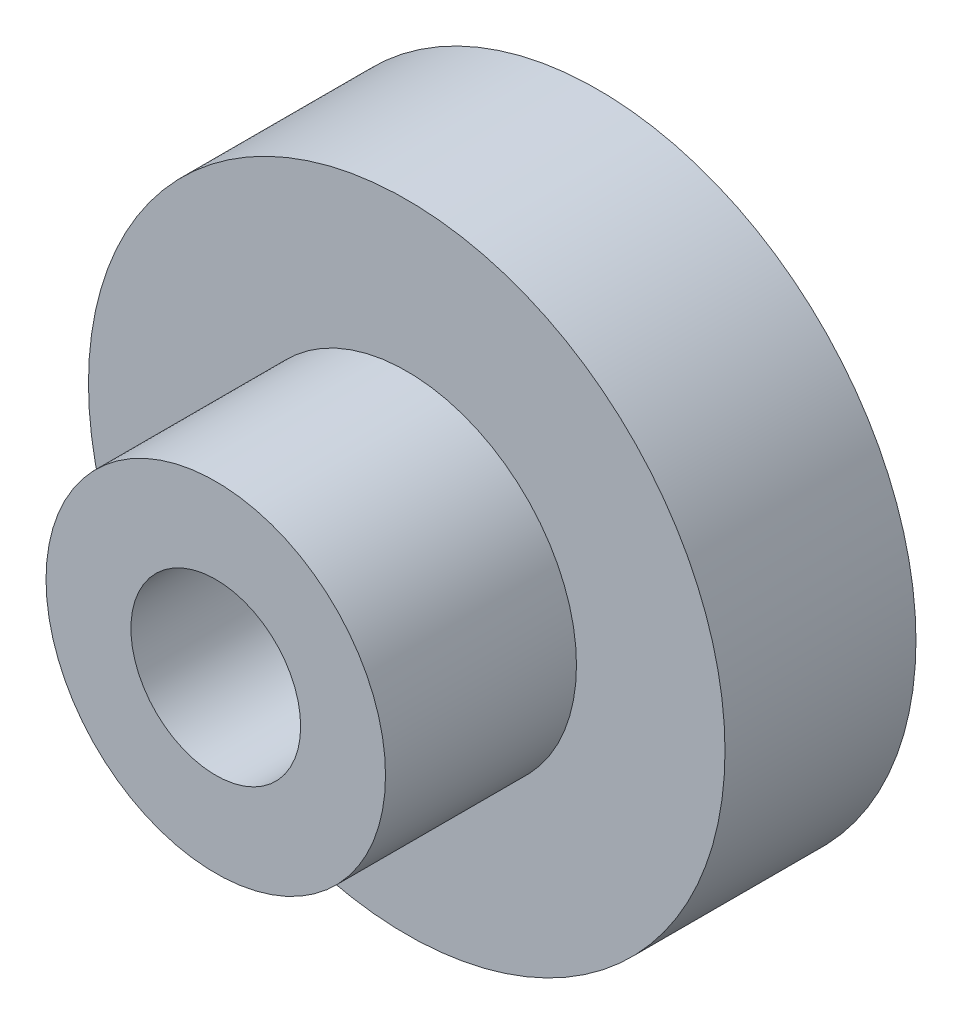
from build123d import *

# Parameters (mm, degrees)
SKETCH_1_R          = 15
EXTRUDE_1_DEPTH     = 9
SKETCH_2_R          = 8
EXTRUDE_2_DEPTH     = 9
SKETCH_3_R          = 4
CUT_EXTRUDE_1_DEPTH = 28
SKETCH_4_R          = 3
CUT_EXTRUDE_2_DEPTH = 28


with BuildPart() as part:
    # 草图1 → 凸台-拉伸1 (new body)
    with BuildSketch(Plane.XY):
        Circle(SKETCH_1_R)
    extrude(amount=EXTRUDE_1_DEPTH)

    # 草图2 → 凸台-拉伸2 (add)
    with BuildSketch(Plane.XY.offset(9)):
        Circle(SKETCH_2_R)
    extrude(amount=EXTRUDE_2_DEPTH)

    # 草图3 → 切除-拉伸1 (cut)
    with BuildSketch(Plane.XY.offset(18)):
        Circle(SKETCH_3_R)
    extrude(amount=-CUT_EXTRUDE_1_DEPTH, mode=Mode.SUBTRACT)

    # 草图4 → 切除-拉伸2 (cut)
    with BuildSketch(Plane(origin=(0, 0, 0), x_dir=(1, 0, 0), z_dir=(0, 1, 0))):
        with Locations(Location((0, -4, 0), (0, 0, 270))):
            Circle(SKETCH_4_R)
    extrude(amount=-CUT_EXTRUDE_2_DEPTH, mode=Mode.SUBTRACT)


solid = part.part
